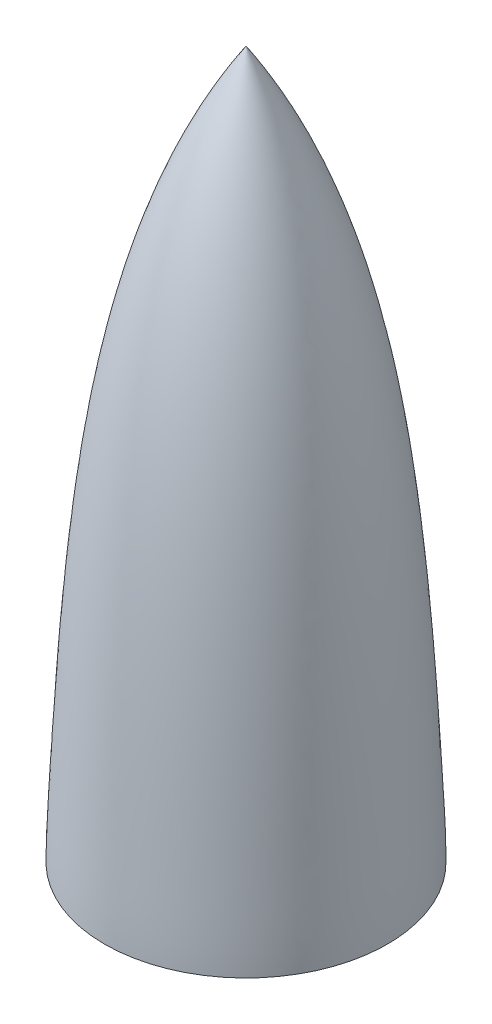
from build123d import *


with BuildPart() as part:
    # Sketch1 → Revolve1 (revolve)
    with BuildSketch(Plane(origin=(0, 0, 0), x_dir=(0, 0, -1), z_dir=(1, 0, 0))):
        with BuildLine():
            Line((76.2, 0), (78.359, 0))
            add(Edge.make_bspline(
                [(0, 391.795), (43.34053541, 325.221489098), (68.728989379, 202.667379204), (75.642285222, 68.447550174), (78.359, 11.913198943), (78.359, 0)],
                knots=[0, 0, 0, 0, 0.579778719, 0.911588503, 1, 1, 1, 1], degree=3))
            Line((0, 391.795), (0, 387.790303549))
            add(Edge.make_bspline(
                [(0, 387.790303549), (29.823352692, 338.940718932), (60.242020193, 238.007452453), (70.911291904, 117.062368112), (74.79761801, 41.464119334), (76.2, 11.680979009), (76.2, 0)],
                knots=[0, 0, 0, 0, 0.42874596, 0.778809241, 0.910512262, 1, 1, 1, 1], degree=3))
        make_face()
    revolve(axis=Axis((0, 0, 0), (0, 1, 0)))


solid = part.part
